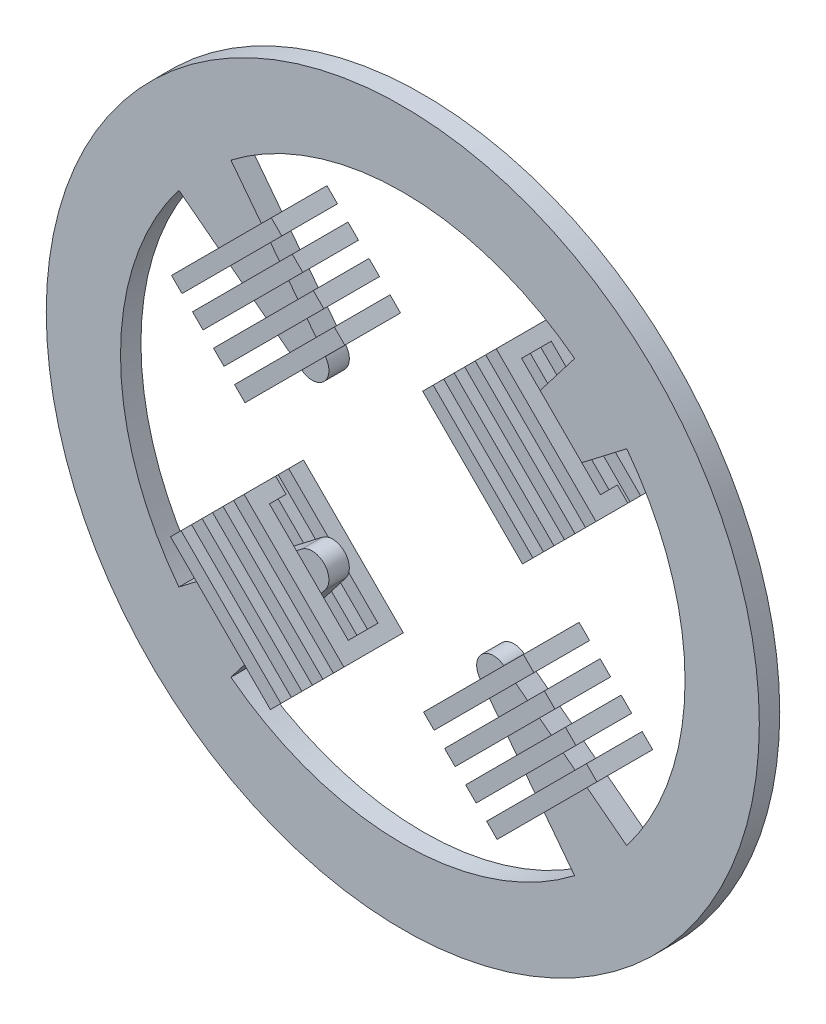
from build123d import *

# Parameters (mm, degrees)
SKETCH_1_R          = 0.96
SKETCH_1_R_2        = 0.76
EXTRUDE_1_DEPTH     = 0.055
EXTRUDE_START       = -0.055
EXTRUDE_2_DEPTH     = 0.055
SKETCH_11_W         = 0.38
SKETCH_11_H         = 0.16
SKETCH_11_W_2       = 0.3
SKETCH_11_H_2       = 0.08
EXTRUDE_3_DEPTH     = 0.04
EXTRUDE_28_DEPTH    = 0.04
SKETCH_64_W         = 0.15
SKETCH_64_H         = 0.38
SKETCH_64_W_2       = 0.07
SKETCH_64_H_2       = 0.3
EXTRUDE_29_DEPTH    = 0.04
SKETCH_68_W         = 0.15
SKETCH_68_H         = 0.38
SKETCH_68_W_2       = 0.07
SKETCH_68_H_2       = 0.3
EXTRUDE_30_DEPTH    = 0.04
SKETCH_69_W         = 0.15
SKETCH_69_H         = 0.38
SKETCH_69_W_2       = 0.07
SKETCH_69_H_2       = 0.3
EXTRUDE_31_DEPTH    = 0.04
SKETCH_70_W         = 0.15
SKETCH_70_H         = 0.38
SKETCH_70_W_2       = 0.07
SKETCH_70_H_2       = 0.3
EXTRUDE_32_DEPTH    = 0.04
SKETCH_71_W         = 0.15
SKETCH_71_H         = 0.38
SKETCH_71_W_2       = 0.07
SKETCH_71_H_2       = 0.3
EXTRUDE_33_DEPTH    = 0.04
SKETCH_72_W         = 0.15
SKETCH_72_H         = 0.38
SKETCH_72_W_2       = 0.07
SKETCH_72_H_2       = 0.3
EXTRUDE_34_DEPTH    = 0.04
SKETCH_73_W         = 0.15
SKETCH_73_H         = 0.38
SKETCH_73_W_2       = 0.07
SKETCH_73_H_2       = 0.3
EXTRUDE_35_DEPTH    = 0.04
SKETCH_76_W         = 0.38
SKETCH_76_H         = 0.16
SKETCH_76_W_2       = 0.3
SKETCH_76_H_2       = 0.08
EXTRUDE_36_DEPTH    = 0.04
SKETCH_77_W         = 0.38
SKETCH_77_H         = 0.16
SKETCH_77_W_2       = 0.3
SKETCH_77_H_2       = 0.08
EXTRUDE_37_DEPTH    = 0.04
SKETCH_78_W         = 0.38
SKETCH_78_H         = 0.16
SKETCH_78_W_2       = 0.3
SKETCH_78_H_2       = 0.08
EXTRUDE_38_DEPTH    = 0.04
SKETCH_79_W         = 0.38
SKETCH_79_H         = 0.16
SKETCH_79_W_2       = 0.3
SKETCH_79_H_2       = 0.08
EXTRUDE_39_DEPTH    = 0.04
SKETCH_80_W         = 0.38
SKETCH_80_H         = 0.16
SKETCH_80_W_2       = 0.3
SKETCH_80_H_2       = 0.08
EXTRUDE_40_DEPTH    = 0.04
SKETCH_81_W         = 0.38
SKETCH_81_H         = 0.16
SKETCH_81_W_2       = 0.3
SKETCH_81_H_2       = 0.08
EXTRUDE_41_DEPTH    = 0.04
SKETCH_82_W         = 0.38
SKETCH_82_H         = 0.16
SKETCH_82_W_2       = 0.3
SKETCH_82_H_2       = 0.08
EXTRUDE_42_DEPTH    = 0.04
SKETCH_84_W         = 0.03426668
SKETCH_84_H         = 0.04
CUT_EXTRUDE_2_DEPTH = 0.5
SKETCH_85_W         = 0.035258794
SKETCH_85_H         = 0.04
CUT_EXTRUDE_3_DEPTH = 0.5


with BuildPart() as part:
    # 草圖1 → 填料-伸長1 (new body)
    with BuildSketch(Plane.XY):
        Circle(SKETCH_1_R)
        Circle(SKETCH_1_R_2, mode=Mode.SUBTRACT)
    extrude(amount=EXTRUDE_1_DEPTH)

    # 草圖2 → 填料-伸長2 (add)
    with BuildSketch(Plane.XY.offset(0.055).offset(EXTRUDE_START)):
        with BuildLine():
            Line((-0.208247811, 0.271393831), (-0.462658686, 0.602948539))
            ThreePointArc((-0.462658686, 0.602948539), (-0.537401154, 0.537401154), (-0.602948539, 0.462658686))
            Line((-0.602948539, 0.462658686), (-0.271393831, 0.208247811))
            ThreePointArc((-0.271393831, 0.208247811), (-0.241031974, 0.199037642), (-0.212132034, 0.212132034))
            ThreePointArc((-0.212132034, 0.212132034), (-0.199037642, 0.241031974), (-0.208247811, 0.271393831))
        make_face()
        with BuildLine():
            ThreePointArc((0.208247811, 0.271393831), (0.199037642, 0.241031974), (0.212132034, 0.212132034))
            ThreePointArc((0.212132034, 0.212132034), (0.241031974, 0.199037642), (0.271393831, 0.208247811))
            Line((0.271393831, 0.208247811), (0.602948539, 0.462658686))
            ThreePointArc((0.602948539, 0.462658686), (0.537401154, 0.537401154), (0.462658686, 0.602948539))
            Line((0.462658686, 0.602948539), (0.208247811, 0.271393831))
        make_face()
        with BuildLine():
            ThreePointArc((0.271393831, -0.208247811), (0.241031974, -0.199037642), (0.212132034, -0.212132034))
            ThreePointArc((0.212132034, -0.212132034), (0.199037642, -0.241031974), (0.208247811, -0.271393831))
            Line((0.208247811, -0.271393831), (0.462658686, -0.602948539))
            ThreePointArc((0.462658686, -0.602948539), (0.537401154, -0.537401154), (0.602948539, -0.462658686))
            Line((0.602948539, -0.462658686), (0.271393831, -0.208247811))
        make_face()
        with BuildLine():
            ThreePointArc((-0.208247811, -0.271393831), (-0.199037642, -0.241031974), (-0.212132034, -0.212132034))
            ThreePointArc((-0.212132034, -0.212132034), (-0.241031974, -0.199037642), (-0.271393831, -0.208247811))
            Line((-0.271393831, -0.208247811), (-0.602948539, -0.462658686))
            ThreePointArc((-0.602948539, -0.462658686), (-0.537401154, -0.537401154), (-0.462658686, -0.602948539))
            Line((-0.462658686, -0.602948539), (-0.208247811, -0.271393831))
        make_face()
    extrude(amount=EXTRUDE_2_DEPTH)


with BuildPart() as body_2:
    # 草圖11 → 填料-伸長3 (new body)
    with BuildSketch(Plane(origin=(0.240416306, 0.240416306, 0), x_dir=(-0.7071067811865476, 0.7071067811865476, 0), z_dir=(0.7071067811865476, 0.7071067811865476, 0))):
        with Locations((0, 0.0275)):
            Rectangle(SKETCH_11_W, SKETCH_11_H)
        with Locations((0, 0.0275)):
            Rectangle(SKETCH_11_W_2, SKETCH_11_H_2, mode=Mode.SUBTRACT)
    extrude(amount=EXTRUDE_3_DEPTH)


with BuildPart() as body_3:
    # 草圖62 → 填料-伸長28 (new body)
    with BuildSketch(Plane(origin=(0.240416306, -0.240416306, 0), x_dir=(0.7071067811865477, 0.7071067811865475, 0), z_dir=(0.7071067811865475, -0.7071067811865477, 0))):
        Polygon((0, -0.005), (0, -0.045), (0.19, -0.045), (0.19, 0.105), (0, 0.105), (0, 0.065), (0.15, 0.065), (0.15, -0.005), align=None)
        Polygon((-0.19, -0.045), (0, -0.045), (0, -0.005), (-0.15, -0.005), (-0.15, 0.065), (0, 0.065), (0, 0.105), (-0.19, 0.105), align=None)
    extrude(amount=EXTRUDE_28_DEPTH)


with BuildPart() as body_4:
    # 草圖64 → 填料-伸長29 (new body)
    with BuildSketch(Plane(origin=(0.296984848, -0.296984848, 0), x_dir=(0, 0, -1), z_dir=(0.7071067811865487, -0.7071067811865464, 0))):
        with Locations((-0.03, 0)):
            Rectangle(SKETCH_64_W, SKETCH_64_H)
        with Locations((-0.03, 0)):
            Rectangle(SKETCH_64_W_2, SKETCH_64_H_2, mode=Mode.SUBTRACT)
    extrude(amount=EXTRUDE_29_DEPTH)


with BuildPart() as body_5:
    # 草圖68 → 填料-伸長30 (new body)
    with BuildSketch(Plane(origin=(0.353553391, -0.353553391, 0), x_dir=(0, 0, -1), z_dir=(0.7071067811865487, -0.7071067811865464, 0))):
        with Locations((-0.03, 0)):
            Rectangle(SKETCH_68_W, SKETCH_68_H)
        with Locations((-0.03, 0)):
            Rectangle(SKETCH_68_W_2, SKETCH_68_H_2, mode=Mode.SUBTRACT)
    extrude(amount=EXTRUDE_30_DEPTH)


with BuildPart() as body_6:
    # 草圖69 → 填料-伸長31 (new body)
    with BuildSketch(Plane(origin=(0.410121933, -0.410121933, 0), x_dir=(0, 0, -1), z_dir=(0.7071067811865487, -0.7071067811865464, 0))):
        with Locations((-0.03, 0)):
            Rectangle(SKETCH_69_W, SKETCH_69_H)
        with Locations((-0.03, 0)):
            Rectangle(SKETCH_69_W_2, SKETCH_69_H_2, mode=Mode.SUBTRACT)
    extrude(amount=EXTRUDE_31_DEPTH)


with BuildPart() as body_7:
    # 草圖70 → 填料-伸長32 (new body)
    with BuildSketch(Plane(origin=(-0.240416306, 0.240416306, 0), x_dir=(0, 0, -1), z_dir=(0.7071067811865487, -0.7071067811865464, 0))):
        with Locations((-0.03, 0)):
            Rectangle(SKETCH_70_W, SKETCH_70_H)
        with Locations((-0.03, 0)):
            Rectangle(SKETCH_70_W_2, SKETCH_70_H_2, mode=Mode.SUBTRACT)
    extrude(amount=-EXTRUDE_32_DEPTH)


with BuildPart() as body_8:
    # 草圖71 → 填料-伸長33 (new body)
    with BuildSketch(Plane(origin=(-0.296984848, 0.296984848, 0), x_dir=(0, 0, -1), z_dir=(0.7071067811865487, -0.7071067811865464, 0))):
        with Locations((-0.03, 0)):
            Rectangle(SKETCH_71_W, SKETCH_71_H)
        with Locations((-0.03, 0)):
            Rectangle(SKETCH_71_W_2, SKETCH_71_H_2, mode=Mode.SUBTRACT)
    extrude(amount=-EXTRUDE_33_DEPTH)


with BuildPart() as body_9:
    # 草圖72 → 填料-伸長34 (new body)
    with BuildSketch(Plane(origin=(-0.353553391, 0.353553391, 0), x_dir=(0, 0, -1), z_dir=(0.7071067811865487, -0.7071067811865464, 0))):
        with Locations((-0.03, 0)):
            Rectangle(SKETCH_72_W, SKETCH_72_H)
        with Locations((-0.03, 0)):
            Rectangle(SKETCH_72_W_2, SKETCH_72_H_2, mode=Mode.SUBTRACT)
    extrude(amount=-EXTRUDE_34_DEPTH)


with BuildPart() as body_10:
    # 草圖73 → 填料-伸長35 (new body)
    with BuildSketch(Plane(origin=(-0.410121933, 0.410121933, 0), x_dir=(0, 0, -1), z_dir=(0.7071067811865487, -0.7071067811865464, 0))):
        with Locations((-0.03, 0)):
            Rectangle(SKETCH_73_W, SKETCH_73_H)
        with Locations((-0.03, 0)):
            Rectangle(SKETCH_73_W_2, SKETCH_73_H_2, mode=Mode.SUBTRACT)
    extrude(amount=-EXTRUDE_35_DEPTH)


with BuildPart() as body_11:
    # 草圖76 → 填料-伸長36 (new body)
    with BuildSketch(Plane(origin=(0.296984848, 0.296984848, 0), x_dir=(0.7071067811865515, -0.7071067811865436, 0), z_dir=(0.7071067811865436, 0.7071067811865515, 0))):
        with Locations((0, -0.0275)):
            Rectangle(SKETCH_76_W, SKETCH_76_H)
        with Locations((0, -0.0275)):
            Rectangle(SKETCH_76_W_2, SKETCH_76_H_2, mode=Mode.SUBTRACT)
    extrude(amount=EXTRUDE_36_DEPTH)


with BuildPart() as body_12:
    # 草圖77 → 填料-伸長37 (new body)
    with BuildSketch(Plane(origin=(0.353553391, 0.353553391, 0), x_dir=(0.7071067811865515, -0.7071067811865436, 0), z_dir=(0.7071067811865436, 0.7071067811865515, 0))):
        with Locations((0, -0.0275)):
            Rectangle(SKETCH_77_W, SKETCH_77_H)
        with Locations((0, -0.0275)):
            Rectangle(SKETCH_77_W_2, SKETCH_77_H_2, mode=Mode.SUBTRACT)
    extrude(amount=EXTRUDE_37_DEPTH)


with BuildPart() as body_13:
    # 草圖78 → 填料-伸長38 (new body)
    with BuildSketch(Plane(origin=(0.410121933, 0.410121933, 0), x_dir=(0.7071067811865515, -0.7071067811865436, 0), z_dir=(0.7071067811865436, 0.7071067811865515, 0))):
        with Locations((0, -0.0275)):
            Rectangle(SKETCH_78_W, SKETCH_78_H)
        with Locations((0, -0.0275)):
            Rectangle(SKETCH_78_W_2, SKETCH_78_H_2, mode=Mode.SUBTRACT)
    extrude(amount=EXTRUDE_38_DEPTH)


with BuildPart() as body_14:
    # 草圖79 → 填料-伸長39 (new body)
    with BuildSketch(Plane(origin=(-0.240416306, -0.240416306, 0), x_dir=(0.7071067811865515, -0.7071067811865436, 0), z_dir=(0.7071067811865436, 0.7071067811865515, 0))):
        with Locations((0, -0.0275)):
            Rectangle(SKETCH_79_W, SKETCH_79_H)
        with Locations((0, -0.0275)):
            Rectangle(SKETCH_79_W_2, SKETCH_79_H_2, mode=Mode.SUBTRACT)
    extrude(amount=-EXTRUDE_39_DEPTH)


with BuildPart() as body_15:
    # 草圖80 → 填料-伸長40 (new body)
    with BuildSketch(Plane(origin=(-0.296984848, -0.296984848, 0), x_dir=(0.7071067811865515, -0.7071067811865436, 0), z_dir=(0.7071067811865436, 0.7071067811865515, 0))):
        with Locations((0, -0.0275)):
            Rectangle(SKETCH_80_W, SKETCH_80_H)
        with Locations((0, -0.0275)):
            Rectangle(SKETCH_80_W_2, SKETCH_80_H_2, mode=Mode.SUBTRACT)
    extrude(amount=-EXTRUDE_40_DEPTH)


with BuildPart() as body_16:
    # 草圖81 → 填料-伸長41 (new body)
    with BuildSketch(Plane(origin=(-0.353553391, -0.353553391, 0), x_dir=(0.7071067811865515, -0.7071067811865436, 0), z_dir=(0.7071067811865436, 0.7071067811865515, 0))):
        with Locations((0, -0.0275)):
            Rectangle(SKETCH_81_W, SKETCH_81_H)
        with Locations((0, -0.0275)):
            Rectangle(SKETCH_81_W_2, SKETCH_81_H_2, mode=Mode.SUBTRACT)
    extrude(amount=-EXTRUDE_41_DEPTH)


with BuildPart() as body_17:
    # 草圖82 → 填料-伸長42 (new body)
    with BuildSketch(Plane(origin=(-0.410121933, -0.410121933, 0), x_dir=(0.7071067811865515, -0.7071067811865436, 0), z_dir=(0.7071067811865436, 0.7071067811865515, 0))):
        with Locations((0, -0.0275)):
            Rectangle(SKETCH_82_W, SKETCH_82_H)
        with Locations((0, -0.0275)):
            Rectangle(SKETCH_82_W_2, SKETCH_82_H_2, mode=Mode.SUBTRACT)
    extrude(amount=-EXTRUDE_42_DEPTH)


with BuildPart() as cut_extrude_2_tool:
    # 草圖84 → 除料-伸長2 (new body)
    with BuildSketch(Plane(origin=(0.438406204, 0.438406204, 0), x_dir=(0, 0, -1), z_dir=(0.7071067811865435, 0.7071067811865517, 0))):
        with Locations((-0.00463334, -0.17)):
            Rectangle(SKETCH_84_W, SKETCH_84_H)
    extrude(amount=-CUT_EXTRUDE_2_DEPTH)


with BuildPart() as body_2_1:
    add(body_2.part)

    # 除料-伸長2: cut by cut_extrude_2_tool
    add(cut_extrude_2_tool.part, mode=Mode.SUBTRACT)


with BuildPart() as body_11_1:
    add(body_11.part)

    # 除料-伸長2: cut by cut_extrude_2_tool
    add(cut_extrude_2_tool.part, mode=Mode.SUBTRACT)


with BuildPart() as body_12_1:
    add(body_12.part)

    # 除料-伸長2: cut by cut_extrude_2_tool
    add(cut_extrude_2_tool.part, mode=Mode.SUBTRACT)


with BuildPart() as body_13_1:
    add(body_13.part)

    # 除料-伸長2: cut by cut_extrude_2_tool
    add(cut_extrude_2_tool.part, mode=Mode.SUBTRACT)


with BuildPart() as cut_extrude_3_tool:
    # 草圖85 → 除料-伸長3 (new body)
    with BuildSketch(Plane(origin=(-0.438406204, -0.438406204, 0), x_dir=(0, 0, 1), z_dir=(-0.7071067811865436, -0.7071067811865515, 0))):
        with Locations((0.005129397, 0.17)):
            Rectangle(SKETCH_85_W, SKETCH_85_H)
    extrude(amount=-CUT_EXTRUDE_3_DEPTH)


with BuildPart() as body_14_1:
    add(body_14.part)

    # 除料-伸長3: cut by cut_extrude_3_tool
    add(cut_extrude_3_tool.part, mode=Mode.SUBTRACT)


with BuildPart() as body_15_1:
    add(body_15.part)

    # 除料-伸長3: cut by cut_extrude_3_tool
    add(cut_extrude_3_tool.part, mode=Mode.SUBTRACT)


with BuildPart() as body_16_1:
    add(body_16.part)

    # 除料-伸長3: cut by cut_extrude_3_tool
    add(cut_extrude_3_tool.part, mode=Mode.SUBTRACT)


with BuildPart() as body_17_1:
    add(body_17.part)

    # 除料-伸長3: cut by cut_extrude_3_tool
    add(cut_extrude_3_tool.part, mode=Mode.SUBTRACT)


solid = Compound([part.part, body_3.part, body_4.part, body_5.part, body_6.part, body_7.part, body_8.part, body_9.part, body_10.part, body_2_1.part, body_11_1.part, body_12_1.part, body_13_1.part, body_14_1.part, body_15_1.part, body_16_1.part, body_17_1.part])
